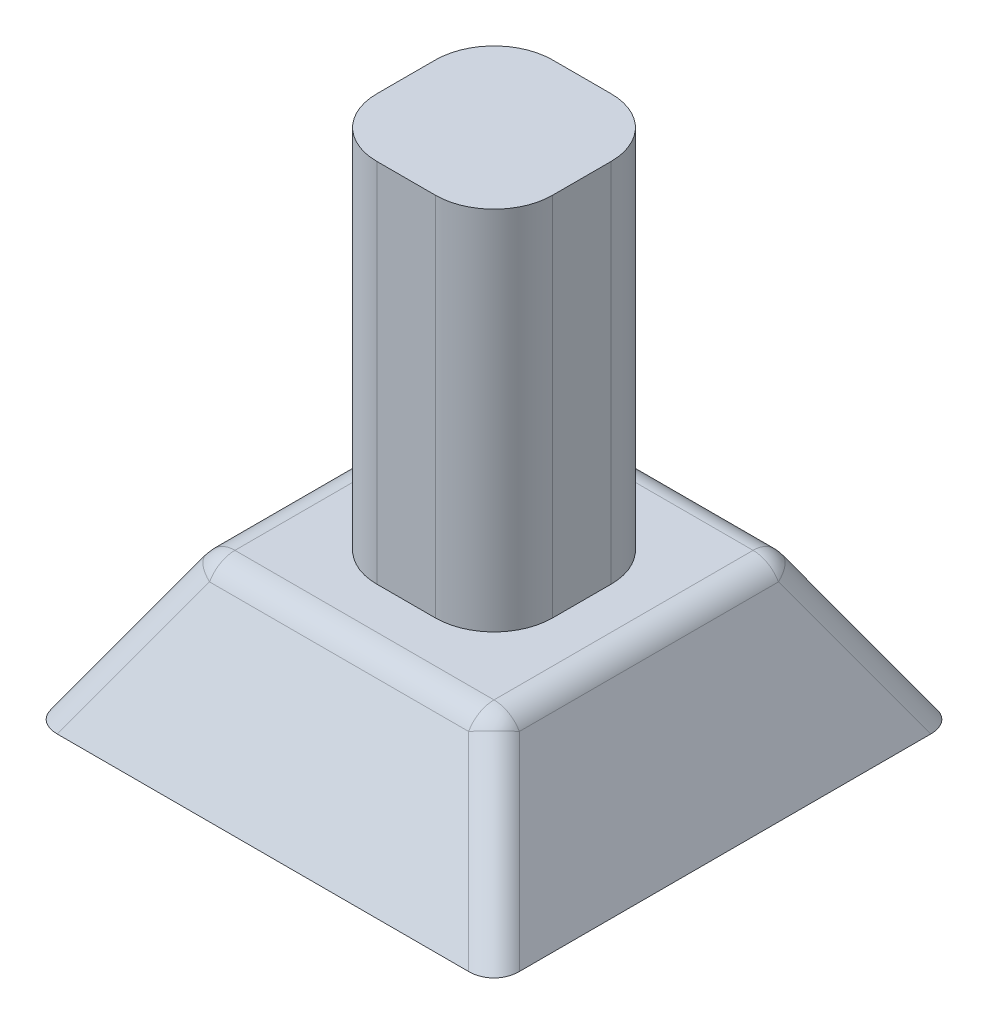
from build123d import *

# Parameters (mm, degrees)
SKETCH1_W           = 15.24
SKETCH1_H           = 15.24
BOSS_EXTRUDE1_DEPTH = 31.75
FILLET1_R           = 5.08
SKETCH2_W           = 25.4
SKETCH2_H           = 25.4
BOSS_EXTRUDE3_DEPTH = 12.7
BOSS_EXTRUDE3_DRAFT = -30
SKETCH5_W           = 29.904696838
SKETCH5_H           = 29.904696838
CUT_EXTRUDE1_DEPTH  = 10.16
CUT_EXTRUDE1_DRAFT  = -30
FILLET2_R           = 2.54


with BuildPart() as part:
    # Sketch1 → Boss-Extrude1 (new body)
    with BuildSketch(Plane(origin=(0, 0, 0), x_dir=(1, 0, 0), z_dir=(0, 1, 0))):
        Rectangle(SKETCH1_W, SKETCH1_H)
    extrude(amount=BOSS_EXTRUDE1_DEPTH)

    # Fillet1
    fillet1_edges = [part.edges().sort_by_distance(p)[0] for p in [
        (-7.62, 15.875, -7.62),
        (7.62, 15.875, -7.62),
        (7.62, 15.875, 7.62),
        (-7.62, 15.875, 7.62),
    ]]
    fillet(fillet1_edges, radius=FILLET1_R)


with BuildPart() as boss_extrude3_tool:
    # Sketch2 → Boss-Extrude3 (with draft: the straight prism first)
    with BuildSketch(Plane.XZ):
        Rectangle(SKETCH2_W, SKETCH2_H)
    extrude(amount=BOSS_EXTRUDE3_DEPTH)
    # Boss-Extrude3: the draft: its side faces are tilted about the plane it starts from
    boss_extrude3_sides = [boss_extrude3_tool.faces().sort_by_distance(p)[0] for p in [
        (12.7, -6.35, 0),
        (0, -6.35, 12.7),
        (-12.7, -6.35, 0),
        (0, -6.35, -12.7),
    ]]
    draft(boss_extrude3_sides, Plane.XZ, BOSS_EXTRUDE3_DRAFT)


with BuildPart() as part_1:
    add(part.part)

    # Boss-Extrude3: add boss_extrude3_tool
    add(boss_extrude3_tool.part)


with BuildPart() as cut_extrude1_tool:
    # Sketch5 → Cut-Extrude1 (with draft: the straight prism first)
    with BuildSketch(Plane.XZ.offset(12.7)):
        Rectangle(SKETCH5_W, SKETCH5_H)
    extrude(amount=-CUT_EXTRUDE1_DEPTH)
    # Cut-Extrude1: the draft: its side faces are tilted about the plane it starts from
    cut_extrude1_sides = [cut_extrude1_tool.faces().sort_by_distance(p)[0] for p in [
        (-14.952348419, -7.62, 0),
        (0, -7.62, -14.952348419),
        (14.952348419, -7.62, 0),
        (0, -7.62, 14.952348419),
    ]]
    draft(cut_extrude1_sides, Plane.XZ.offset(12.7), CUT_EXTRUDE1_DRAFT)


with BuildPart() as part_2:
    add(part_1.part)

    # Cut-Extrude1: cut by cut_extrude1_tool
    add(cut_extrude1_tool.part, mode=Mode.SUBTRACT)

    # Fillet2
    fillet2_edges = [part_2.edges().sort_by_distance(p)[0] for p in [
        (-12.7, 0, 0),
        (-16.366174209, -6.35, 16.366174209),
        (0, 0, -12.7),
        (-16.366174209, -6.35, -16.366174209),
        (12.7, 0, 0),
        (16.366174209, -6.35, -16.366174209),
        (0, 0, 12.7),
        (16.366174209, -6.35, 16.366174209),
    ]]
    fillet(fillet2_edges, radius=FILLET2_R)


solid = part_2.part
